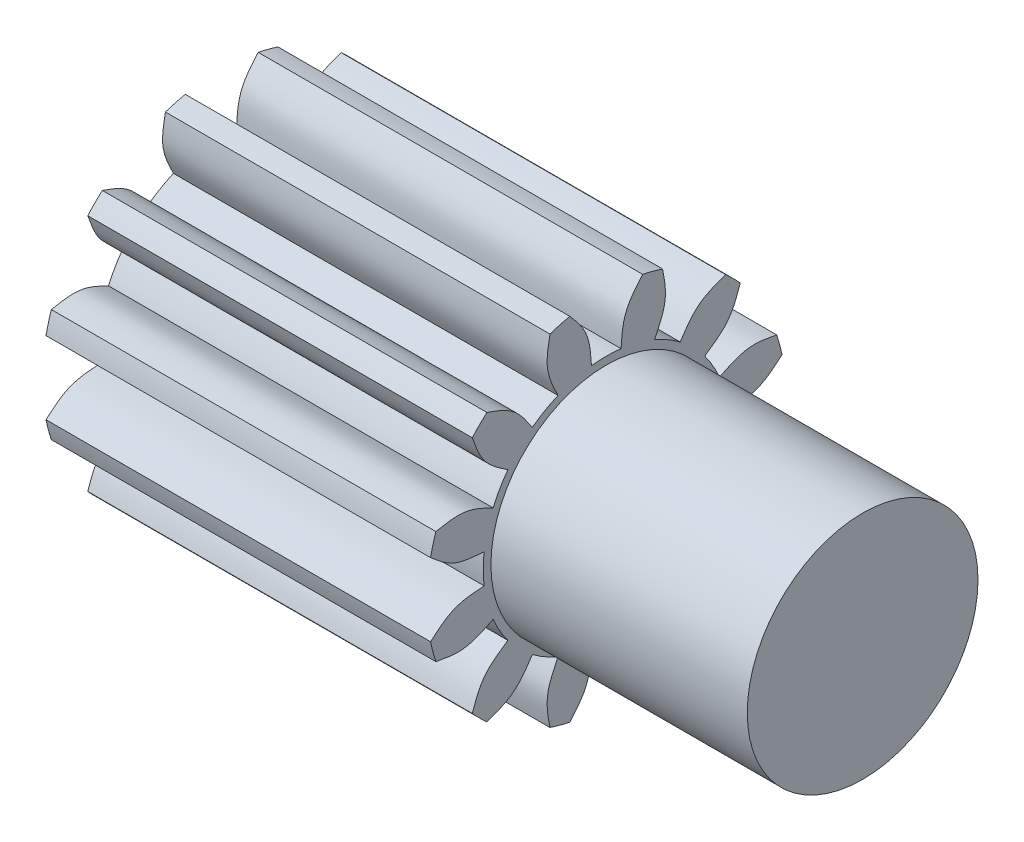
from build123d import *

# Parameters (mm, degrees)
KUGGLUCKA_DEPTH  = 15
CIRPATTERN_COUNT = 12


with BuildPart() as part:
    # Ritning 1 → Kugghjulsämne (revolve)
    with BuildSketch(Plane.XY, mode=Mode.PRIVATE) as kugghjuls_mne_sk:
        Polygon((12.5, 1), (2.5, 1), (2.5, 3.5), (-12.5, 3.5), (-12.5, -3.5), (12.5, -3.5), align=None)
    revolve(kugghjuls_mne_sk.sketch.rotate(Axis((-12.5, -3.5, 0), (1, 0, 0)), 90), axis=Axis((-12.5, -3.5, 0), (1, 0, 0)))

    # Ritning 2 → Kugglucka (cut)
    with BuildSketch(Plane.ZY.offset(12.5)):
        with BuildLine():
            Line((1.419865071, 3.354486354), (0, 4.774351425))
            Line((0, 4.774351425), (-1.419865071, 3.354486354))
            add(Edge.make_bspline(
                [(-1.419865071, 3.354486354), (-1.173032372, 3.067088657), (-0.658113481, 2.467546927), (-0.604624671, 1.6768746), (-0.576776379, 1.265220772)],
                knots=[0, 0, 0, 0, 0.479362292, 1, 1, 1, 1], degree=3))
            ThreePointArc((-0.576776379, 1.265220772), (0, 1.3), (0.576776379, 1.265220772))
            add(Edge.make_bspline(
                [(1.419865071, 3.354486354), (1.173032372, 3.067088657), (0.658113481, 2.467546927), (0.604624671, 1.6768746), (0.576776379, 1.265220772)],
                knots=[0, 0, 0, 0, 0.479362292, 1, 1, 1, 1], degree=3))
        make_face()
    kugglucka = extrude(amount=-KUGGLUCKA_DEPTH, mode=Mode.SUBTRACT)

    # CirPattern: Kugglucka ×12 about axis
    cirpattern_axis = Axis((-12.5, -3.5, 0), (-1, 0, 0))
    for i in range(1, CIRPATTERN_COUNT):
        add(kugglucka.rotate(cirpattern_axis, i * 360 / CIRPATTERN_COUNT), mode=Mode.SUBTRACT)


solid = part.part
